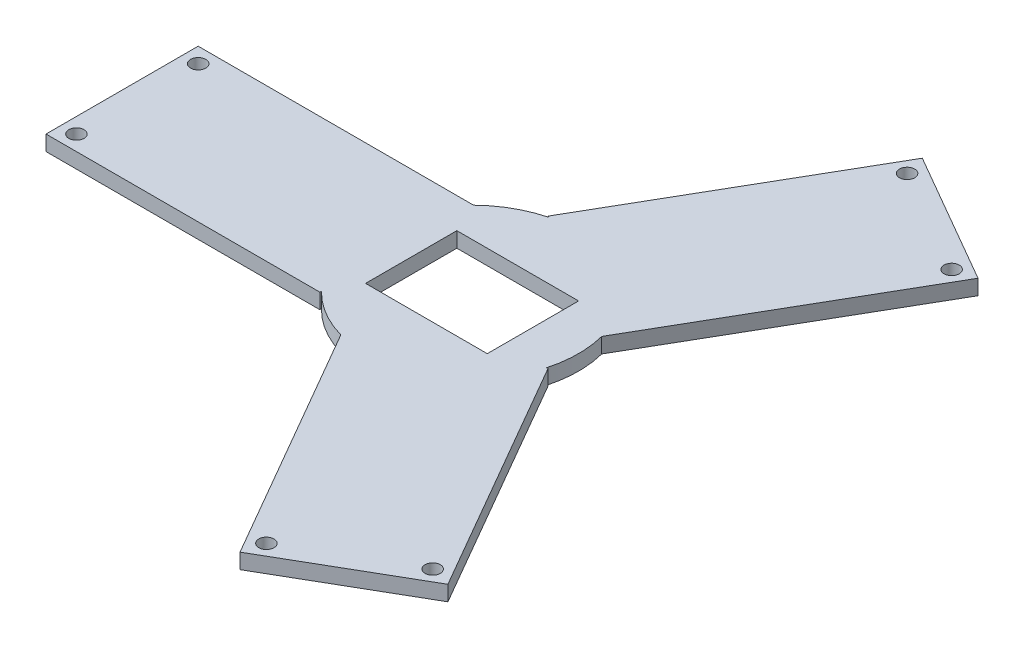
from build123d import *

# Parameters (mm, degrees)
ESQUISSE3_R             = 2.5
BOSS_EXTRU_3_DEPTH      = 5
ESQUISSE4_W             = 40
ESQUISSE4_H             = 30
ENL_V_MAT_EXTRU_1_DEPTH = 161.669919512


with BuildPart() as part:
    # Esquisse3 → Boss.-Extru.3 (new body)
    with BuildSketch(Plane(origin=(0, 0, 0), x_dir=(1, 0, 0), z_dir=(0, 1, 0))):
        with BuildLine():
            Line((-115, -25), (-25, -25))
            Line((-25, -25), (-24.99494949, -24.500051021))
            ThreePointArc((-24.99494949, -24.500051021), (-17.805293657, -30.132565736), (-9.403186381, -33.713203436))
            Line((-9.403186381, -33.713203436), (35.849364905, -112.092921435))
            Line((35.849364905, -112.092921435), (79.150635095, -87.092921435))
            Line((79.150635095, -87.092921435), (34.150635095, -9.150635095))
            Line((34.150635095, -9.150635095), (33.715141323, -9.396235714))
            ThreePointArc((33.715141323, -9.396235714), (34.998214236, -0.353553761), (33.898083809, 8.713203436))
            Line((33.898083809, 8.713203436), (79.150635095, 87.092921435))
            Line((79.150635095, 87.092921435), (35.849364905, 112.092921435))
            Line((35.849364905, 112.092921435), (-9.150635095, 34.150635095))
            Line((-9.150635095, 34.150635095), (-8.720191833, 33.896286735))
            ThreePointArc((-8.720191833, 33.896286735), (-17.19292058, 30.486119496), (-24.494897428, 25))
            Line((-24.494897428, 25), (-115, 25))
            Line((-115, 25), (-115, -25))
        make_face()
        with Locations(Location((-110, -20, 0), (0, 0, 270))):
            Circle(ESQUISSE3_R, mode=Mode.SUBTRACT)
        with Locations(Location((-110, 20, 0), (0, 0, 270))):
            Circle(ESQUISSE3_R, mode=Mode.SUBTRACT)
        with Locations(Location((72.320508076, -85.262794416, 0), (0, 0, 270))):
            Circle(ESQUISSE3_R, mode=Mode.SUBTRACT)
        with Locations(Location((37.679491924, -105.262794416, 0), (0, 0, 270))):
            Circle(ESQUISSE3_R, mode=Mode.SUBTRACT)
        with Locations(Location((72.320508076, 85.262794416, 0), (0, 0, 270))):
            Circle(ESQUISSE3_R, mode=Mode.SUBTRACT)
        with Locations(Location((37.679491924, 105.262794416, 0), (0, 0, 270))):
            Circle(ESQUISSE3_R, mode=Mode.SUBTRACT)
    extrude(amount=BOSS_EXTRU_3_DEPTH)

    # Esquisse4 → Enlèv. mat.-Extru.1 (cut, through all)
    with BuildSketch(Plane(origin=(0, 5, 0), x_dir=(1, 0, 0), z_dir=(0, 1, 0))):
        Rectangle(ESQUISSE4_W, ESQUISSE4_H)
    extrude(amount=-ENL_V_MAT_EXTRU_1_DEPTH, mode=Mode.SUBTRACT)


solid = part.part
